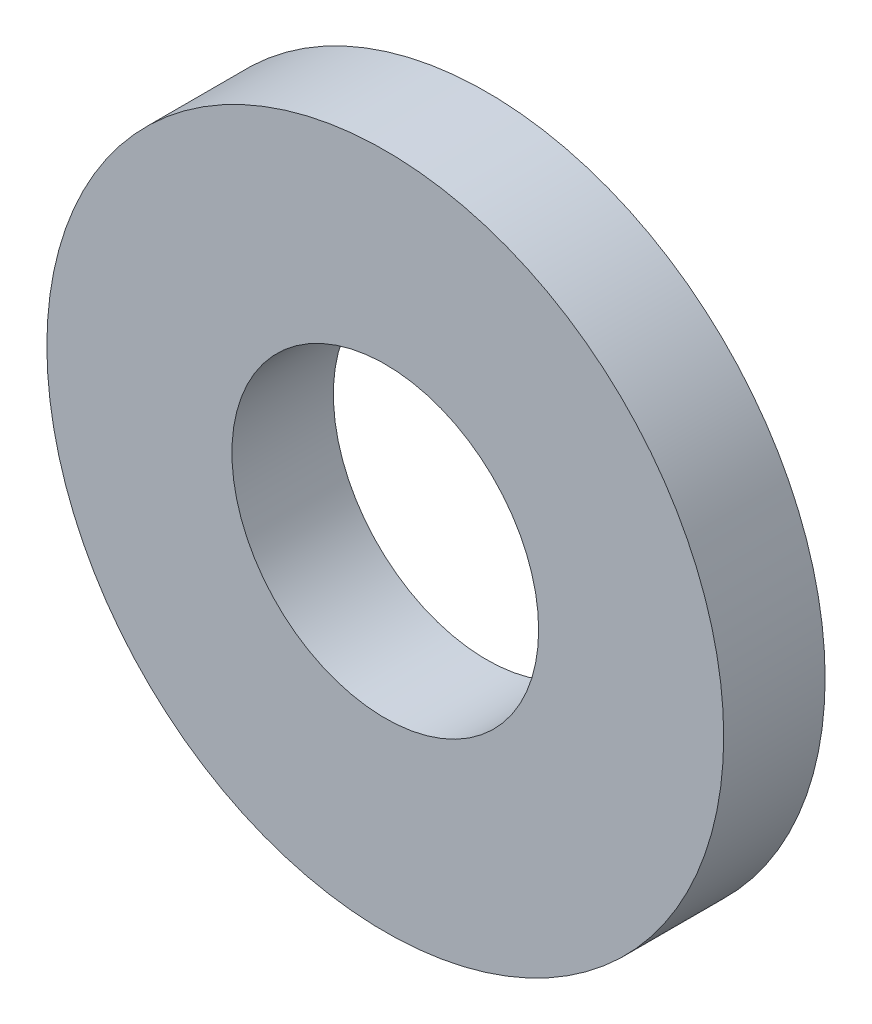
from build123d import *

# Parameters (mm, degrees)
SKETCH1_R           = 5.254625
SKETCH1_R_2         = 2.38125
BOSS_EXTRUDE1_DEPTH = 1.5748


with BuildPart() as part:
    # Sketch1 → Boss-Extrude1 (new body)
    with BuildSketch(Plane.XY):
        Circle(SKETCH1_R)
        Circle(SKETCH1_R_2, mode=Mode.SUBTRACT)
    extrude(amount=BOSS_EXTRUDE1_DEPTH)


solid = part.part
